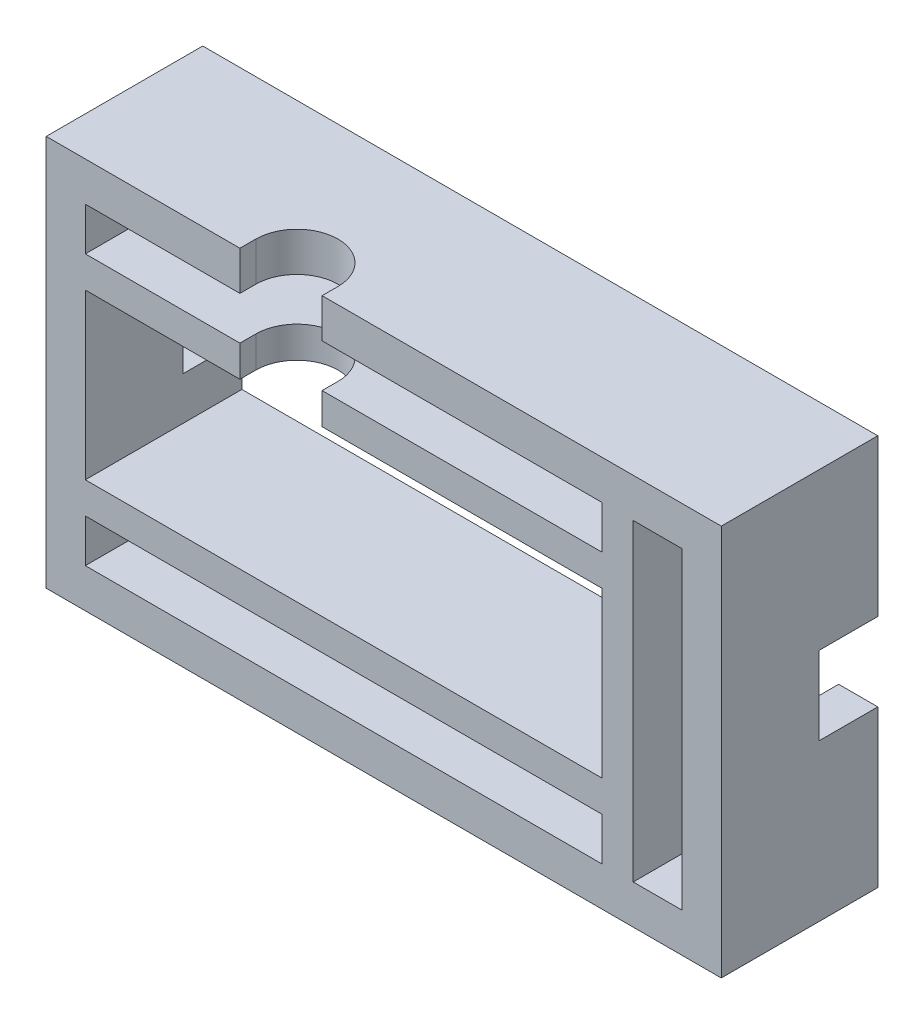
from build123d import *

# Parameters (mm, degrees)
SKETCH1_W               = 34.5
SKETCH1_H               = 20
BOSS_EXTRUDE1_DEPTH     = 2
SKETCH2_W               = 26.4
SKETCH2_H               = 2.2
SKETCH2_W_2             = 2.5
SKETCH2_H_2             = 16
SKETCH2_H_3             = 8.4
BOSS_EXTRUDE2_DEPTH     = 10
CUT_EXTRUDE1_DEPTH      = 17.5
CUT_EXTRUDE1_DEPTH_BACK = 17.5
SKETCH3_W               = 3
SKETCH3_H               = 4
CUT_EXTRUDE2_DEPTH      = 10
FILLET1_R               = 2
BOSS_EXTRUDE3_DEPTH     = 5
SKETCH7_W               = 34.5
SKETCH7_H               = 20
CUT_EXTRUDE3_DEPTH      = 2


with BuildPart() as part:
    # Sketch1 → Boss-Extrude1 (new body)
    with BuildSketch(Plane.XY):
        Rectangle(SKETCH1_W, SKETCH1_H)
    extrude(amount=BOSS_EXTRUDE1_DEPTH)

    # Sketch2 → Boss-Extrude2 (add)
    with BuildSketch(Plane.XY):
        Polygon((-17.25, 10), (17.25, 10), (17.25, 8), (17.25, -8), (17.25, -10), (-17.25, -10), align=None)
        with Locations((-2.05, 6.9)):
            Rectangle(SKETCH2_W, SKETCH2_H, mode=Mode.SUBTRACT)
        with Locations((-2.05, -6.9)):
            Rectangle(SKETCH2_W, SKETCH2_H, mode=Mode.SUBTRACT)
        with Locations((14, 0)):
            Rectangle(SKETCH2_W_2, SKETCH2_H_2, mode=Mode.SUBTRACT)
        with Locations((-2.05, 0)):
            Rectangle(SKETCH2_W, SKETCH2_H_3, mode=Mode.SUBTRACT)
    extrude(amount=BOSS_EXTRUDE2_DEPTH)

    # Sketch3 → Cut-Extrude1 (cut, two sides: drawn at the far end of the back side and taken through both)
    with BuildSketch(Plane(origin=(0, 0, 0), x_dir=(0, 0, -1), z_dir=(1, 0, 0)).offset(-CUT_EXTRUDE1_DEPTH_BACK)):
        with Locations((-3.5, 0)):
            Rectangle(SKETCH3_W, SKETCH3_H)
    extrude(amount=CUT_EXTRUDE1_DEPTH + CUT_EXTRUDE1_DEPTH_BACK, mode=Mode.SUBTRACT)

    # Sketch4 → Cut-Extrude2 (cut)
    with BuildSketch(Plane(origin=(0, 10, 0), x_dir=(1, 0, 0), z_dir=(0, 1, 0))):
        with BuildLine():
            Line((-7.35, -9.1875), (-7.35, -11.2875))
            Line((-7.35, -11.2875), (-3.15, -11.2875))
            Line((-3.15, -11.2875), (-3.15, -9.1875))
            ThreePointArc((-3.15, -9.1875), (-5.25, -7.0875), (-7.35, -9.1875))
        make_face()
    extrude(amount=-CUT_EXTRUDE2_DEPTH, mode=Mode.SUBTRACT)

    # Fillet1
    fillet1_edges = [part.edges().sort_by_distance(p)[0] for p in [
        (0, -10, 0),
        (0, 10, 0),
    ]]
    fillet(fillet1_edges, radius=FILLET1_R)

    # Sketch6 → Boss-Extrude3 (add)
    with BuildSketch(Plane(origin=(0, 10, 0), x_dir=(1, 0, 0), z_dir=(0, 1, 0))):
        Polygon((-7.75, -2), (-2.75, -2), (-2.75, -4), (-4.5, -4), (-4.5, -6), (-6, -6), (-6, -4), (-7.75, -4), align=None)
    extrude(amount=-BOSS_EXTRUDE3_DEPTH)

    # Sketch7 → Cut-Extrude3 (cut)
    with BuildSketch(Plane.XY):
        Rectangle(SKETCH7_W, SKETCH7_H)
    extrude(amount=CUT_EXTRUDE3_DEPTH, mode=Mode.SUBTRACT)


solid = part.part
